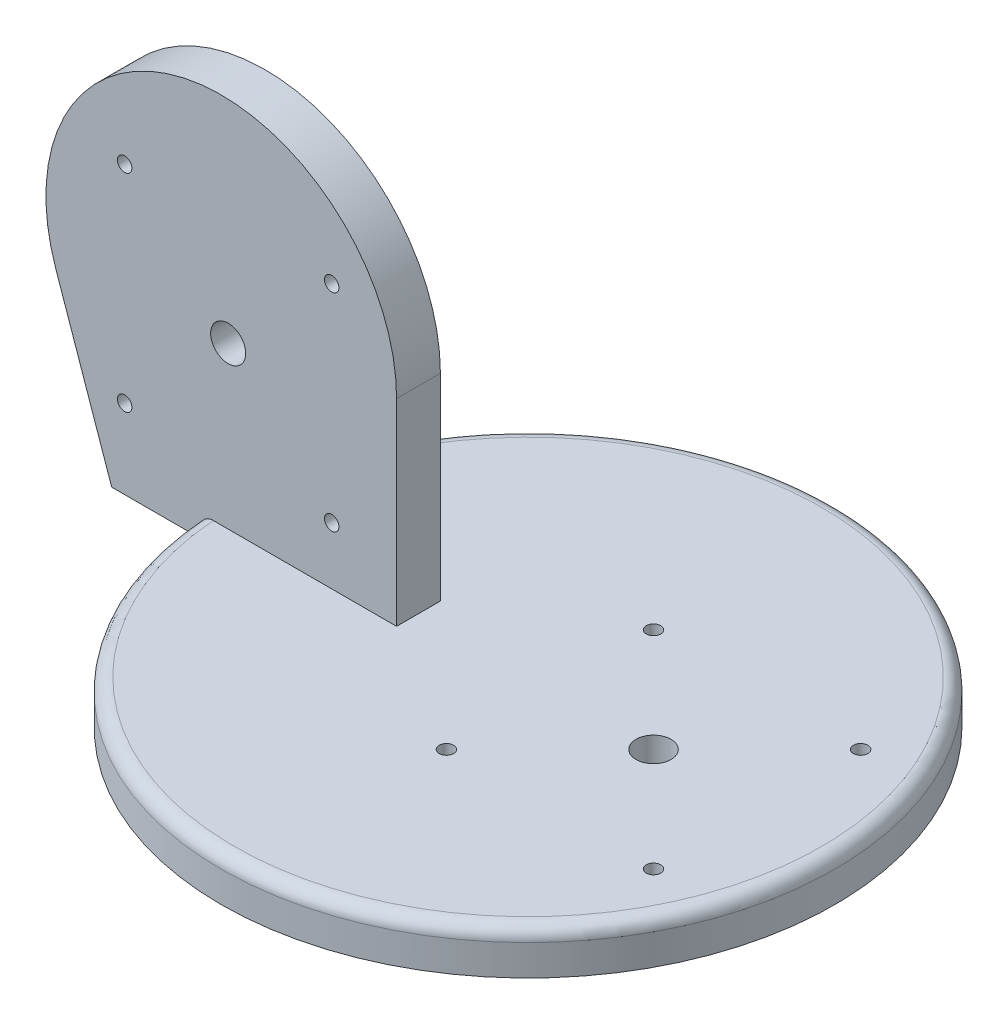
from build123d import *

# Parameters (mm, degrees)
SKETCH1_R                 = 70
BOSS_EXTRUDE1_DEPTH       = 10
SKETCH2_R                 = 65
BOSS_EXTRUDE4_DEPTH       = 3
BOSS_EXTRUDE5_DEPTH       = 5
M4X0_7_TAPPED_HOLE1_D     = 3.3
M4X0_7_TAPPED_HOLE1_DEPTH = 6
M4X0_7_TAPPED_HOLE1_TIP   = 0.991420021
F_8_0MM_DOWEL_HOLE2_D     = 8
M4X0_7_TAPPED_HOLE3_D     = 3.3
M4X0_7_TAPPED_HOLE3_DEPTH = 6
M4X0_7_TAPPED_HOLE3_TIP   = 0.991420021
F_8_0MM_DOWEL_HOLE3_D     = 8
FILLET1_R                 = 3


with BuildPart() as part:
    # Sketch1 → Boss-Extrude1 (new body)
    with BuildSketch(Plane(origin=(0, 0, 0), x_dir=(1, 0, 0), z_dir=(0, 1, 0))):
        with Locations(Location((0, 0, 0), (0, 0, 270))):
            Circle(SKETCH1_R)
    extrude(amount=BOSS_EXTRUDE1_DEPTH)

    # Sketch2 → Boss-Extrude4 (add)
    with BuildSketch(Plane.XZ):
        with Locations(Location((0, 0, 0), (0, 0, 270))):
            Circle(SKETCH2_R)
    extrude(amount=BOSS_EXTRUDE4_DEPTH)

    # Sketch3 → Boss-Extrude5 (add, symmetric)
    with BuildSketch(Plane.XY):
        with BuildLine():
            Line((-25, 55), (-25, 5))
            Line((-25, 5), (-90, 5))
            Line((-90, 5), (-102.792798963, 41.896399481))
            ThreePointArc((-102.792798963, 41.896399481), (-71.644096684, 94.444340269), (-25, 55))
        make_face()
    extrude(amount=BOSS_EXTRUDE5_DEPTH, both=True)

    # M4x0.7 Tapped Hole1
    with Locations(Plane(origin=(0, 10, 0), x_dir=(1, 0, 0), z_dir=(0, 1, 0))):
        with Locations((5, 23.622), (52.244, 23.622), (52.244, -23.622), (5, -23.622)):
            Hole(M4X0_7_TAPPED_HOLE1_D / 2, depth=M4X0_7_TAPPED_HOLE1_DEPTH)
            with Locations((0, 0, -(M4X0_7_TAPPED_HOLE1_DEPTH + M4X0_7_TAPPED_HOLE1_TIP / 2))):  # 118° drill point
                Cone(0, M4X0_7_TAPPED_HOLE1_D / 2, M4X0_7_TAPPED_HOLE1_TIP, mode=Mode.SUBTRACT)

    # Ø8.0mm Dowel Hole2 (through all)
    with Locations(Plane(origin=(0, 0, -5), x_dir=(1, 0, 0), z_dir=(0, 0, -1))):
        with Locations((-63.420285579, -46.697024874)):
            Hole(F_8_0MM_DOWEL_HOLE2_D / 2)

    # M4x0.7 Tapped Hole3
    with Locations(Plane.XY.offset(5)):
        with Locations((-87.040285579, 70.317024874), (-39.800285579, 70.317024874), (-39.800285579, 23.077024874), (-87.040285579, 23.077024874)):
            Hole(M4X0_7_TAPPED_HOLE3_D / 2, depth=M4X0_7_TAPPED_HOLE3_DEPTH)
            with Locations((0, 0, -(M4X0_7_TAPPED_HOLE3_DEPTH + M4X0_7_TAPPED_HOLE3_TIP / 2))):  # 118° drill point
                Cone(0, M4X0_7_TAPPED_HOLE3_D / 2, M4X0_7_TAPPED_HOLE3_TIP, mode=Mode.SUBTRACT)

    # Ø8.0mm Dowel Hole3 (through all)
    with Locations(Plane(origin=(0, 10, 0), x_dir=(1, 0, 0), z_dir=(0, 1, 0))):
        with Locations((28.624, -0.002)):
            Hole(F_8_0MM_DOWEL_HOLE3_D / 2)

    # Fillet1
    fillet1_edges = [part.edges().sort_by_distance(p)[0] for p in [
        (51.23475383, 10, -47.696960071),
    ]]
    fillet(fillet1_edges, radius=FILLET1_R)


solid = part.part
